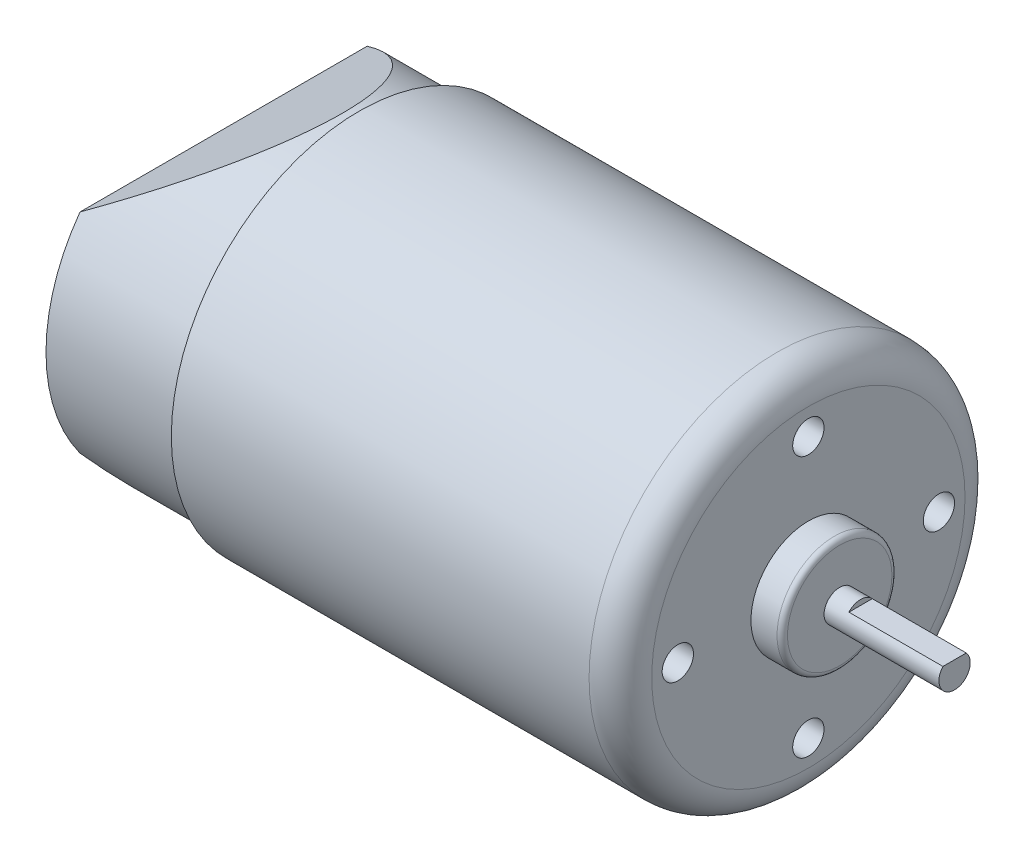
from build123d import *

# Parameters (mm, degrees)
SKETCH1_R                           = 18
BOSS_EXTRUDE1_DEPTH                 = 56
FILLET1_R                           = 3
CUT_EXTRUDE1_START                  = -14.96663
CUT_EXTRUDE1_DEPTH                  = 29.93326
SKETCH3_W                           = 13
SKETCH3_H                           = 1
SKETCH4_R                           = 5.5
BOSS_EXTRUDE2_DEPTH                 = 3
FILLET2_R                           = 0.5
SKETCH5_R                           = 1.5
BOSS_EXTRUDE3_DEPTH                 = 11
CUT_EXTRUDE2_REACH                  = 76.485
CUT_EXTRUDE2_END_RADIUS             = 1.5
SKETCH6_W                           = 9
SKETCH6_H                           = 0.5
CUT_EXTRUDE2_DIRECTION_2_REACH      = 76.485
CUT_EXTRUDE2_DIRECTION_2_END_RADIUS = 1.5
SKETCH7_R                           = 1.5
CUT_EXTRUDE3_DEPTH                  = 3


with BuildPart() as part:
    # Sketch1 → Boss-Extrude1 (new body)
    with BuildSketch(Plane(origin=(0, 0, 0), x_dir=(0, 0, -1), z_dir=(1, 0, 0))):
        Circle(SKETCH1_R)
    extrude(amount=BOSS_EXTRUDE1_DEPTH)

    # Fillet1
    fillet1_edges = [part.edges().sort_by_distance(p)[0] for p in [
        (56, 0, 18),
    ]]
    fillet(fillet1_edges, radius=FILLET1_R)

    # Sketch2 → Cut-Extrude1 (cut)
    with BuildSketch(Plane.XY.offset(CUT_EXTRUDE1_START)):
        Polygon((13, 18), (0, 10), (0, -10), (13, -18), (0, -18), (-7.803780753, 17.225837115), (0, 18), align=None)
    extrude(amount=CUT_EXTRUDE1_DEPTH, mode=Mode.SUBTRACT)

    # Sketch3 → Cut-Revolve1 (revolve, cut)
    with BuildSketch(Plane.XY, mode=Mode.PRIVATE) as cut_revolve1_sk:
        with Locations((6.5, 17.5)):
            Rectangle(SKETCH3_W, SKETCH3_H)
    revolve(cut_revolve1_sk.sketch.rotate(Axis((-1000, 0, 0), (1, 0, 0)), 90), axis=Axis((-1000, 0, 0), (1, 0, 0)), mode=Mode.SUBTRACT)

    # Sketch4 → Boss-Extrude2 (add)
    with BuildSketch(Plane(origin=(56, 0, 0), x_dir=(0, 0, -1), z_dir=(1, 0, 0))):
        Circle(SKETCH4_R)
    extrude(amount=BOSS_EXTRUDE2_DEPTH)

    # Fillet2
    fillet2_edges = [part.edges().sort_by_distance(p)[0] for p in [
        (59, 0, 5.5),
    ]]
    fillet(fillet2_edges, radius=FILLET2_R)

    # Sketch5 → Boss-Extrude3 (add)
    with BuildSketch(Plane(origin=(59, 0, 0), x_dir=(0, 0, -1), z_dir=(1, 0, 0))):
        Circle(SKETCH5_R)
    extrude(amount=BOSS_EXTRUDE3_DEPTH)

    # Cut-Extrude2: up to this cylinder (the profile starts inside it)
    cut_extrude2_end = Plane(origin=(65.5, 0, 0), z_dir=(-1, 0, 0)) * Cylinder(CUT_EXTRUDE2_END_RADIUS, 156.97, mode=Mode.PRIVATE)
    # Sketch6 → Cut-Extrude2 (cut, up to the surface)
    with BuildSketch(Plane.XY, mode=Mode.PRIVATE) as cut_extrude2_sk1:
        with Locations((65.5, 1.25)):
            Rectangle(SKETCH6_W, SKETCH6_H)
    cut_extrude2_tool1 = extrude(cut_extrude2_sk1.sketch, amount=-CUT_EXTRUDE2_REACH, mode=Mode.PRIVATE) & cut_extrude2_end
    add(cut_extrude2_tool1.solids().sort_by_distance((65.5, 1.25, 0))[0], mode=Mode.SUBTRACT)

    # Cut-Extrude2 direction 2: up to this cylinder (the profile starts inside it)
    cut_extrude2_direction_2_end = Plane(origin=(65.5, 0, 0), z_dir=(-1, 0, 0)) * Cylinder(CUT_EXTRUDE2_DIRECTION_2_END_RADIUS, 156.97, mode=Mode.PRIVATE)
    # Sketch6 → Cut-Extrude2 direction 2 (cut, up to the surface)
    with BuildSketch(Plane.XY, mode=Mode.PRIVATE) as cut_extrude2_direction_2_sk1:
        with Locations((65.5, 1.25)):
            Rectangle(SKETCH6_W, SKETCH6_H)
    cut_extrude2_direction_2_tool1 = extrude(cut_extrude2_direction_2_sk1.sketch, amount=CUT_EXTRUDE2_DIRECTION_2_REACH, mode=Mode.PRIVATE) & cut_extrude2_direction_2_end
    add(cut_extrude2_direction_2_tool1.solids().sort_by_distance((65.5, 1.25, 0))[0], mode=Mode.SUBTRACT)

    # Sketch7 → Cut-Extrude3 (cut)
    with BuildSketch(Plane(origin=(56, 0, 0), x_dir=(0, 0, -1), z_dir=(1, 0, 0))):
        with Locations((0, 12.5)):
            Circle(SKETCH7_R)
        with Locations((12.5, 0)):
            Circle(SKETCH7_R)
        with Locations((0, -12.5)):
            Circle(SKETCH7_R)
        with Locations((-12.5, 0)):
            Circle(SKETCH7_R)
    extrude(amount=-CUT_EXTRUDE3_DEPTH, mode=Mode.SUBTRACT)


solid = part.part
